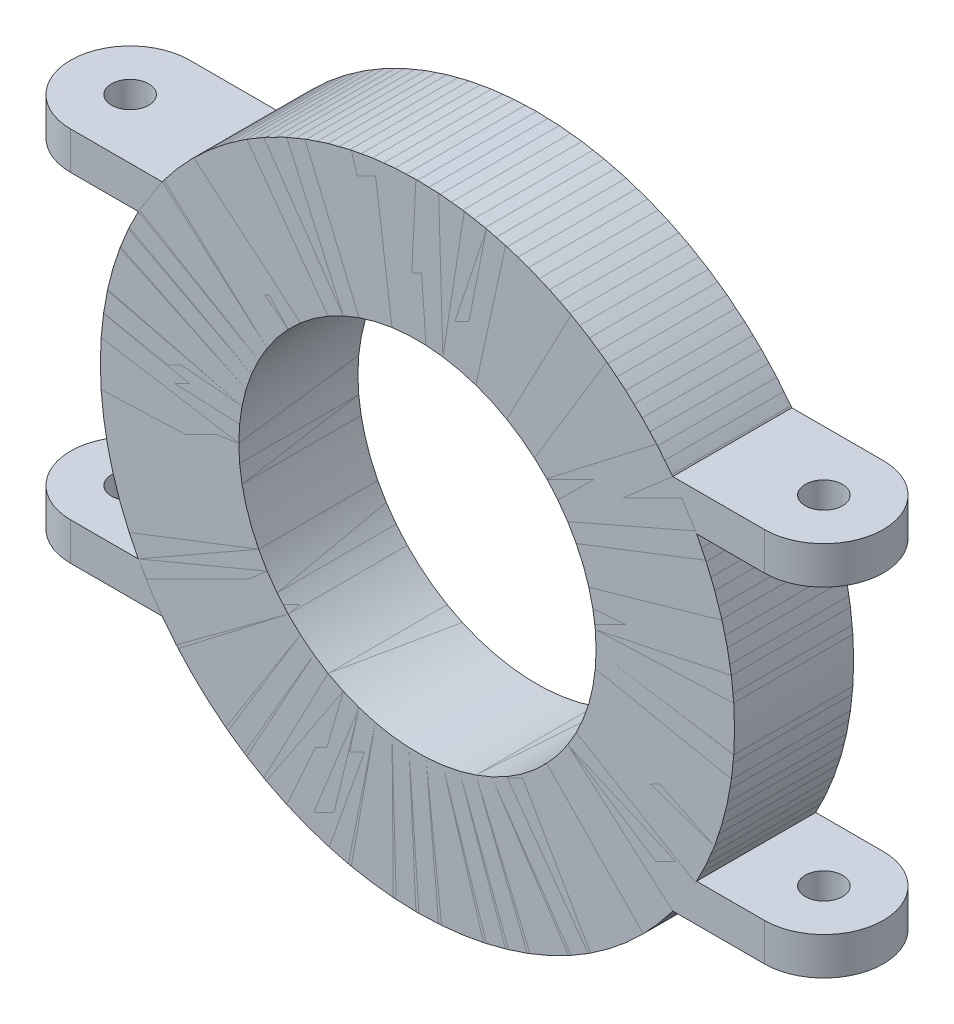
from build123d import *

# Parameters (mm, degrees)
SKETCH2_R           = 21.3
SKETCH2_R_2         = 12
BOSS_EXTRUDE1_DEPTH = 8
SKETCH3_W           = 8
SKETCH3_H           = 2.531451489
BOSS_EXTRUDE2_DEPTH = 7
SKETCH4_W           = 4
SKETCH4_H           = 2.531451489
SKETCH5_W           = 4
SKETCH5_H           = 2.531451489
CUT_EXTRUDE1_REACH  = 46.282
SKETCH6_R           = 1.25
CIRPATTERN2_COUNT   = 2


with BuildPart() as part:
    # Sketch2 → Boss-Extrude1 (new body)
    with BuildSketch(Plane.XY):
        Circle(SKETCH2_R)
        Circle(SKETCH2_R_2, mode=Mode.SUBTRACT)
    extrude(amount=BOSS_EXTRUDE1_DEPTH)

    # Sketch3 → Boss-Extrude2 (add)
    with BuildSketch(Plane(origin=(16.3, 0, 0), x_dir=(0, 0, -1), z_dir=(1, 0, 0))):
        with Locations((-4, -11.369631879)):
            Rectangle(SKETCH3_W, SKETCH3_H)
        with Locations((-4, 11.369631879)):
            Rectangle(SKETCH3_W, SKETCH3_H)
    extrude(amount=BOSS_EXTRUDE2_DEPTH)

    # Sketch4 → Revolve1 (revolve)
    with BuildSketch(Plane(origin=(23.3, 0, 0), x_dir=(0, 0, -1), z_dir=(1, 0, 0))):
        with Locations((-2, 11.369631879)):
            Rectangle(SKETCH4_W, SKETCH4_H)
    revolve(axis=Axis((23.3, 10.103906134, 4), (0, 1, 0)))

    # Sketch5 → Revolve2 (revolve)
    with BuildSketch(Plane(origin=(23.3, 0, 0), x_dir=(0, 0, -1), z_dir=(1, 0, 0))):
        with Locations((-2, -11.369631879)):
            Rectangle(SKETCH5_W, SKETCH5_H)
    revolve(axis=Axis((23.3, -12.635357623, 4), (0, 1, 0)))

    # Cut-Extrude1: up to this face of the body (flat: up to its plane)
    cut_extrude1_end = Plane(part.part.faces().sort_by_distance((21.837440816, 12.635357623, 4))[0])
    # Sketch6 → Cut-Extrude1 (cut, up to the picked face)
    with BuildSketch(Plane(origin=(0, -12.635357623, 0), x_dir=(-1, 0, 0), z_dir=(0, -1, 0)), mode=Mode.PRIVATE) as cut_extrude1_sk1:
        with Locations(Location((-23.3, -4, 0), (0, 0, 90))):
            Circle(SKETCH6_R)
    cut_extrude1_tool1 = split(extrude(cut_extrude1_sk1.sketch, amount=-CUT_EXTRUDE1_REACH, mode=Mode.PRIVATE), bisect_by=cut_extrude1_end, keep=Keep.BOTH, mode=Mode.PRIVATE)
    add(cut_extrude1_tool1.solids().sort_by(Axis((23.3, -12.635358, 4), (0, 1, 0)))[0], mode=Mode.SUBTRACT)


with BuildPart() as cirpattern2_1:
    # CirPattern2: pattern copy
    add(part.part.rotate(Axis((0, 0, 0), (0, 0, 1)), 1 * 360 / CIRPATTERN2_COUNT))


solid = Compound([part.part, cirpattern2_1.part])
